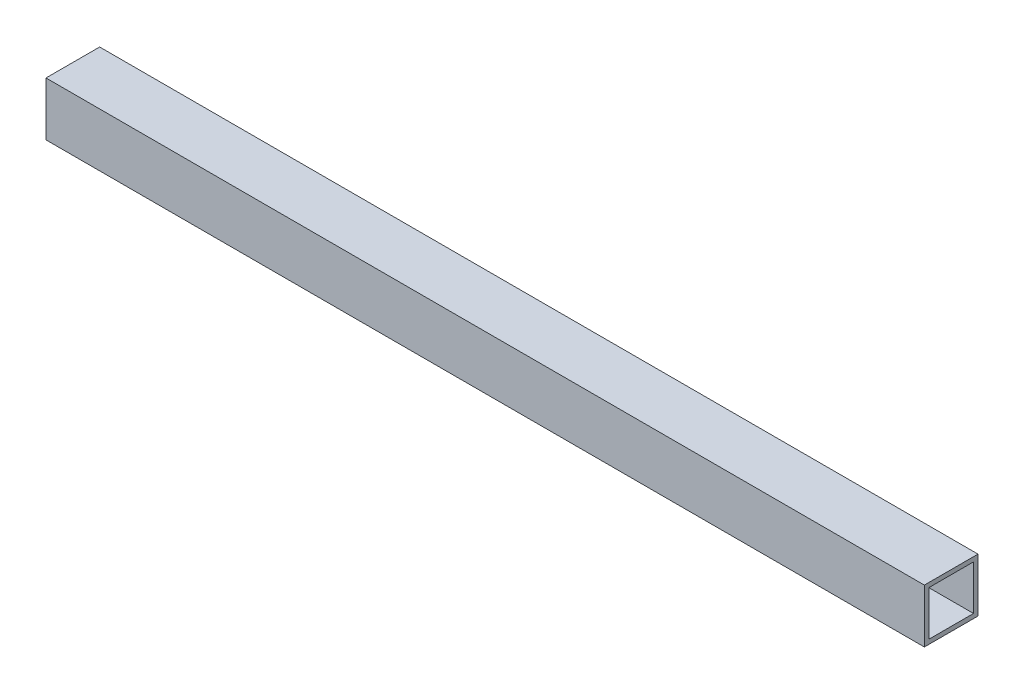
from build123d import *

# Parameters (mm, degrees)
SKETCH1_W           = 19.05
SKETCH1_H           = 19.05
SKETCH1_W_2         = 15.875
SKETCH1_H_2         = 15.875
BOSS_EXTRUDE1_DEPTH = 311.9


with BuildPart() as part:
    # Sketch1 → Boss-Extrude1 (new body)
    with BuildSketch(Plane(origin=(-983.143696964, 0, 0), x_dir=(0, 0, -1), z_dir=(1, 0, 0))):
        with Locations((-760.107848365, 71.368450435)):
            Rectangle(SKETCH1_W, SKETCH1_H)
        with Locations((-760.107848365, 71.368450435)):
            Rectangle(SKETCH1_W_2, SKETCH1_H_2, mode=Mode.SUBTRACT)
    extrude(amount=BOSS_EXTRUDE1_DEPTH)


solid = part.part
